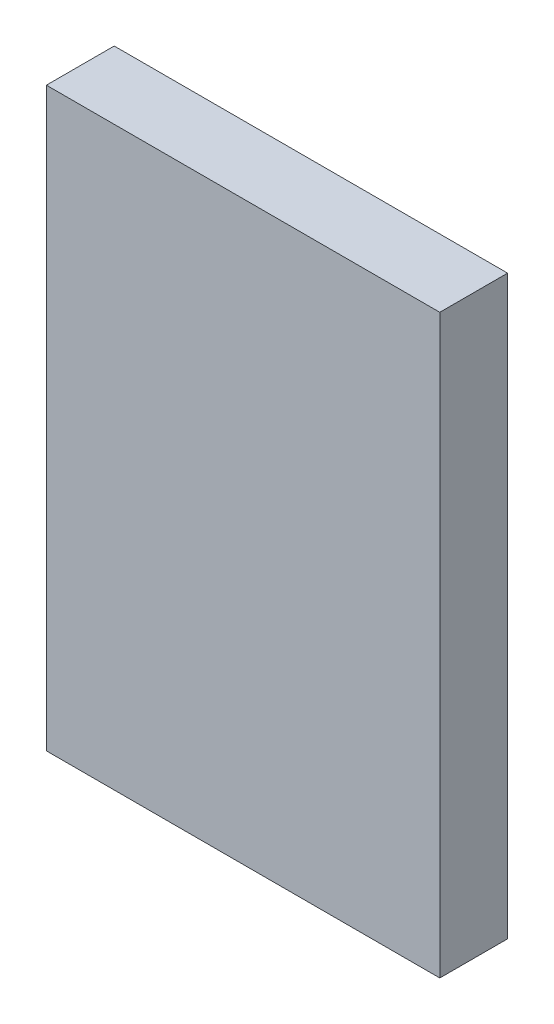
from build123d import *

# Parameters (mm, degrees)
SKETCH_1_W      = 58
SKETCH_1_H      = 85
EXTRUDE_1_DEPTH = 10


with BuildPart() as part:
    # 草图1 → 凸台-拉伸1 (new body)
    with BuildSketch(Plane.XY):
        Rectangle(SKETCH_1_W, SKETCH_1_H)
    extrude(amount=EXTRUDE_1_DEPTH)


solid = part.part
